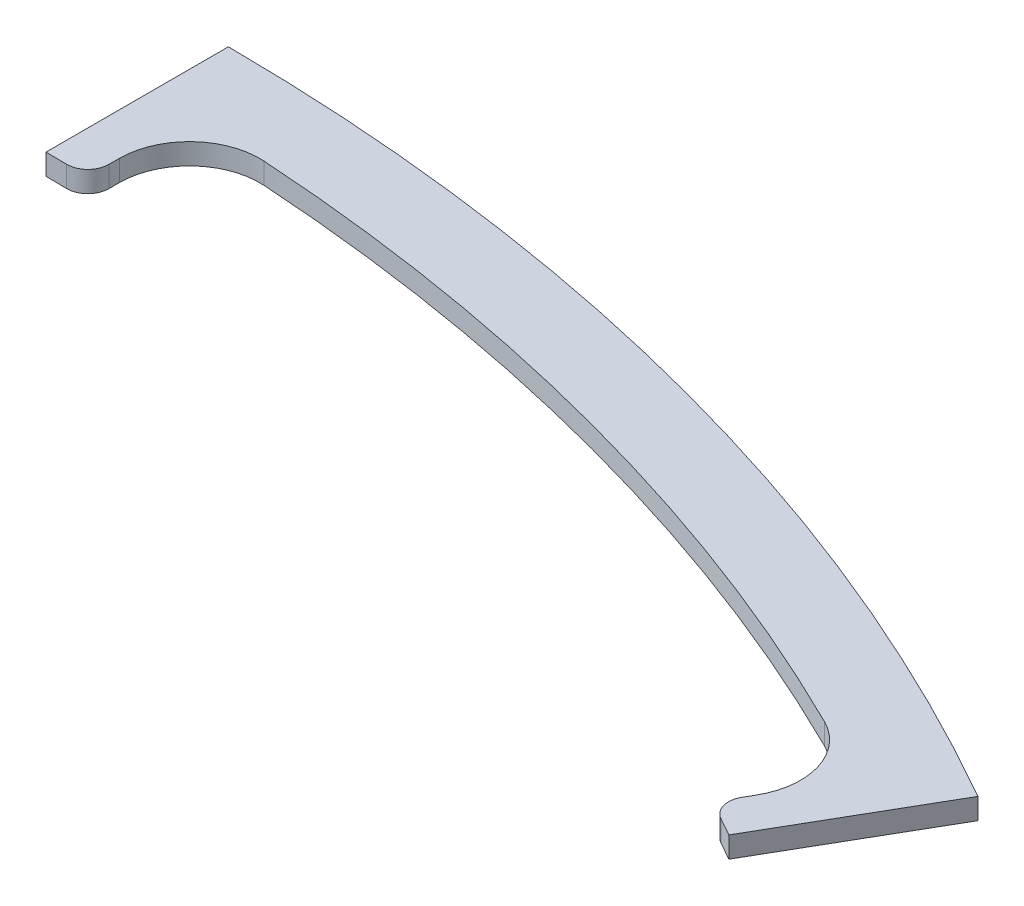
from build123d import *

# Parameters (mm, degrees)
BOSS_EXTRUDE1_DEPTH = 3
CUT_EXTRUDE1_DEPTH  = 3
FILLET1_R           = 10
FILLET2_R           = 3


with BuildPart() as part:
    # Sketch1 → Boss-Extrude1 (new body)
    with BuildSketch(Plane(origin=(0, 0, 0), x_dir=(1, 0, 0), z_dir=(0, 1, 0))):
        with BuildLine():
            Line((1.5, 297.496218463), (1.5, 271.496218463))
            ThreePointArc((1.5, 271.496218463), (70.269464473, 262.249211634), (134.449071126, 235.872622221))
            Line((134.449071126, 235.872622221), (147.449071126, 258.389282719))
            ThreePointArc((147.449071126, 258.389282719), (76.998665918, 287.362933321), (1.5, 297.496218463))
        make_face()
    extrude(amount=BOSS_EXTRUDE1_DEPTH)

    # Sketch3 → Cut-Extrude1 (cut)
    with BuildSketch(Plane(origin=(0, 3, 0), x_dir=(1, 0, 0), z_dir=(0, 1, 0))):
        with BuildLine():
            Line((7.5, 271.396751344), (129.203185143, 238.786481168))
            Line((129.203185143, 238.786481168), (136.70589842, 251.781561758))
            ThreePointArc((136.70589842, 251.781561758), (74.15175015, 276.738099028), (7.5, 286.402177897))
            Line((7.5, 286.402177897), (7.5, 271.396751344))
        make_face()
    extrude(amount=-CUT_EXTRUDE1_DEPTH, mode=Mode.SUBTRACT)

    # Fillet1
    fillet1_edges = [part.edges().sort_by_distance(p)[0] for p in [
        (7.5, 1.5, -286.402177897),
        (136.70589842, 1.5, -251.781561758),
    ]]
    fillet(fillet1_edges, radius=FILLET1_R)

    # Fillet2
    fillet2_edges = [part.edges().sort_by_distance(p)[0] for p in [
        (7.5, 1.5, -271.396751344),
        (129.203185143, 1.5, -238.786481168),
    ]]
    fillet(fillet2_edges, radius=FILLET2_R)


solid = part.part
